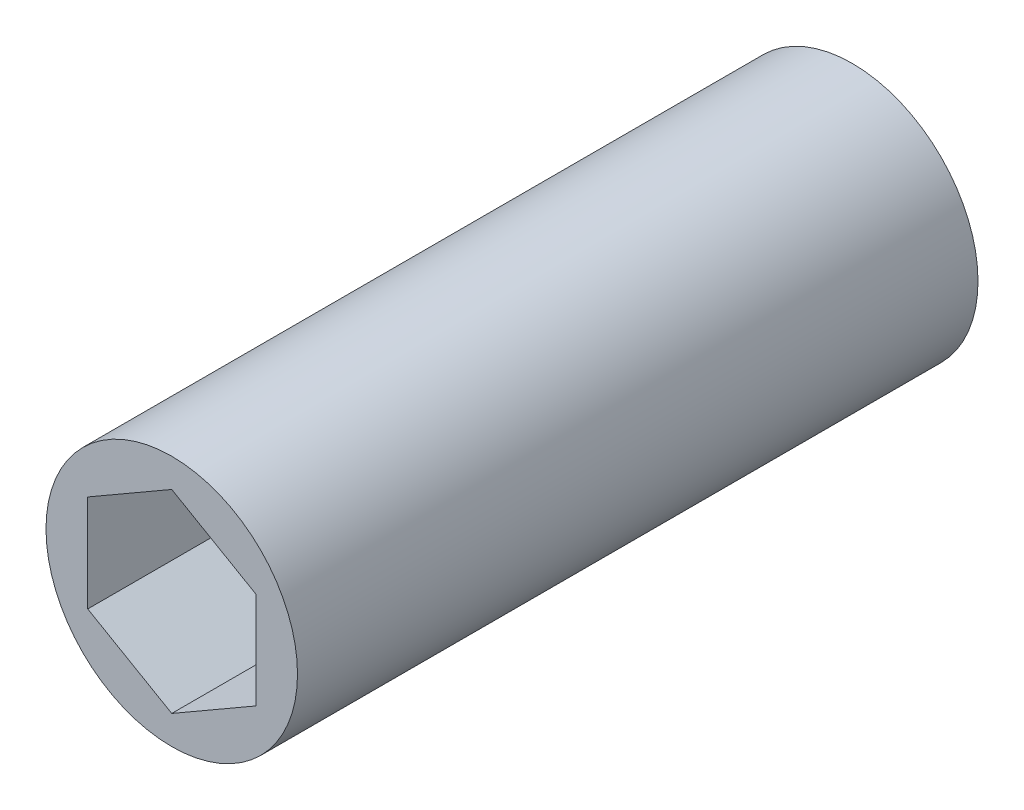
from build123d import *

# Parameters (mm, degrees)
SKETCH1_R           = 9.525
BOSS_EXTRUDE1_DEPTH = 25.772244043


with BuildPart() as part:
    # Sketch1 → Boss-Extrude1 (new, symmetric)
    with BuildSketch(Plane.XY):
        Circle(SKETCH1_R)
        Polygon((6.3627, 3.673506558), (0, 7.347013116), (-6.3627, 3.673506558), (-6.3627, -3.673506558), (0, -7.347013116), (6.3627, -3.673506558), align=None, mode=Mode.SUBTRACT)
    extrude(amount=BOSS_EXTRUDE1_DEPTH, both=True)


solid = part.part
